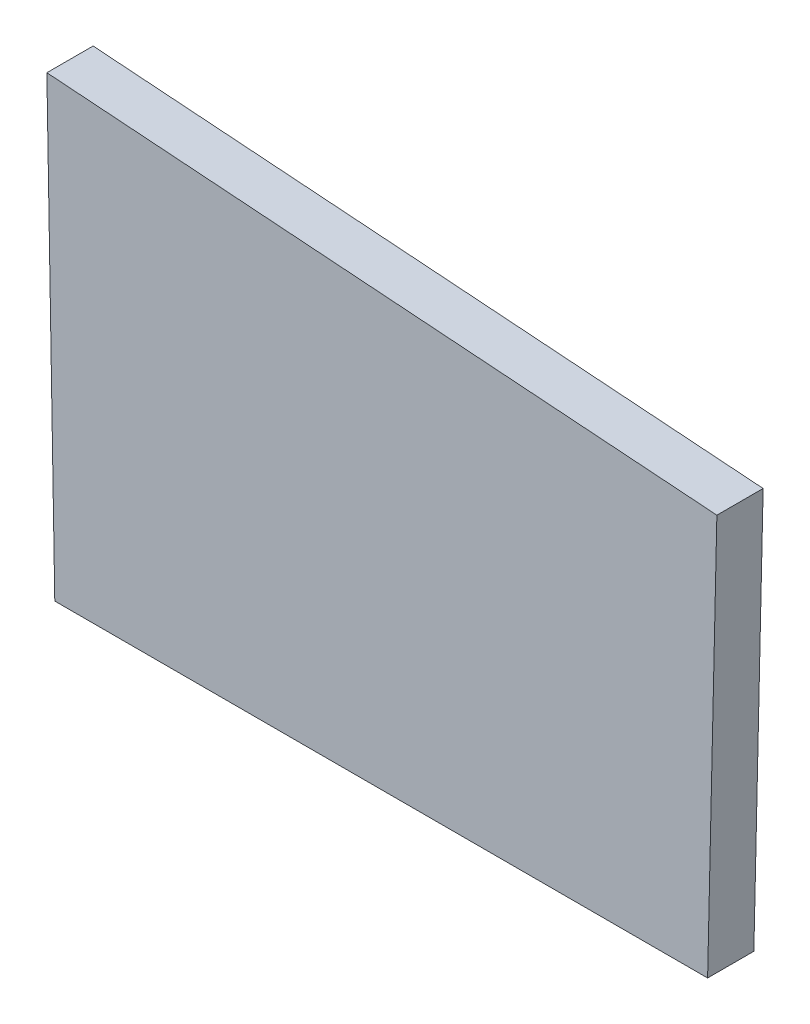
from build123d import *

# Parameters (mm, degrees)
AUFSATZ_LINEAR_AUSTRAGEN1_DEPTH = 2


with BuildPart() as part:
    # Skizze1 → Aufsatz-Linear austragen1 (new body)
    with BuildSketch(Plane.XY):
        Polygon((0, 0), (-0.342416214, 19.617011779), (28.630950621, 17.53341617), (28.23, 0), align=None)
    extrude(amount=AUFSATZ_LINEAR_AUSTRAGEN1_DEPTH)


solid = part.part
